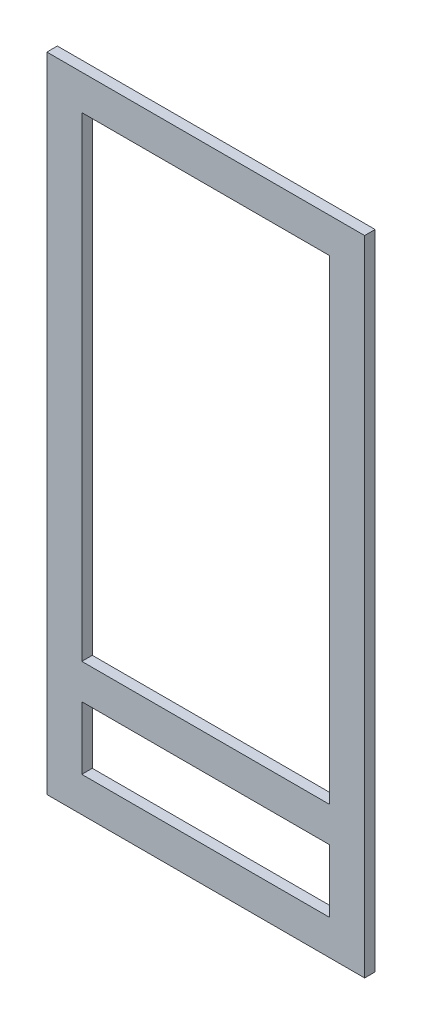
from build123d import *

# Parameters (mm, degrees)
CROQUIS1_W              = 454.7
CROQUIS1_H              = 920
CROQUIS1_W_2            = 354.7
CROQUIS1_H_2            = 680
SALIENTE_EXTRUIR1_DEPTH = 15
CROQUIS2_W              = 354.7
CROQUIS2_H              = 90
CORTAR_EXTRUIR1_DEPTH   = 15


with BuildPart() as part:
    # Croquis1 → Saliente-Extruir1 (new body)
    with BuildSketch(Plane.XY):
        Rectangle(CROQUIS1_W, CROQUIS1_H)
        with Locations((0, 70)):
            Rectangle(CROQUIS1_W_2, CROQUIS1_H_2, mode=Mode.SUBTRACT)
    extrude(amount=-SALIENTE_EXTRUIR1_DEPTH)

    # Croquis2 → Cortar-Extruir1 (cut)
    with BuildSketch(Plane.XY):
        with Locations((0, -365)):
            Rectangle(CROQUIS2_W, CROQUIS2_H)
    extrude(amount=-CORTAR_EXTRUIR1_DEPTH, mode=Mode.SUBTRACT)


solid = part.part
